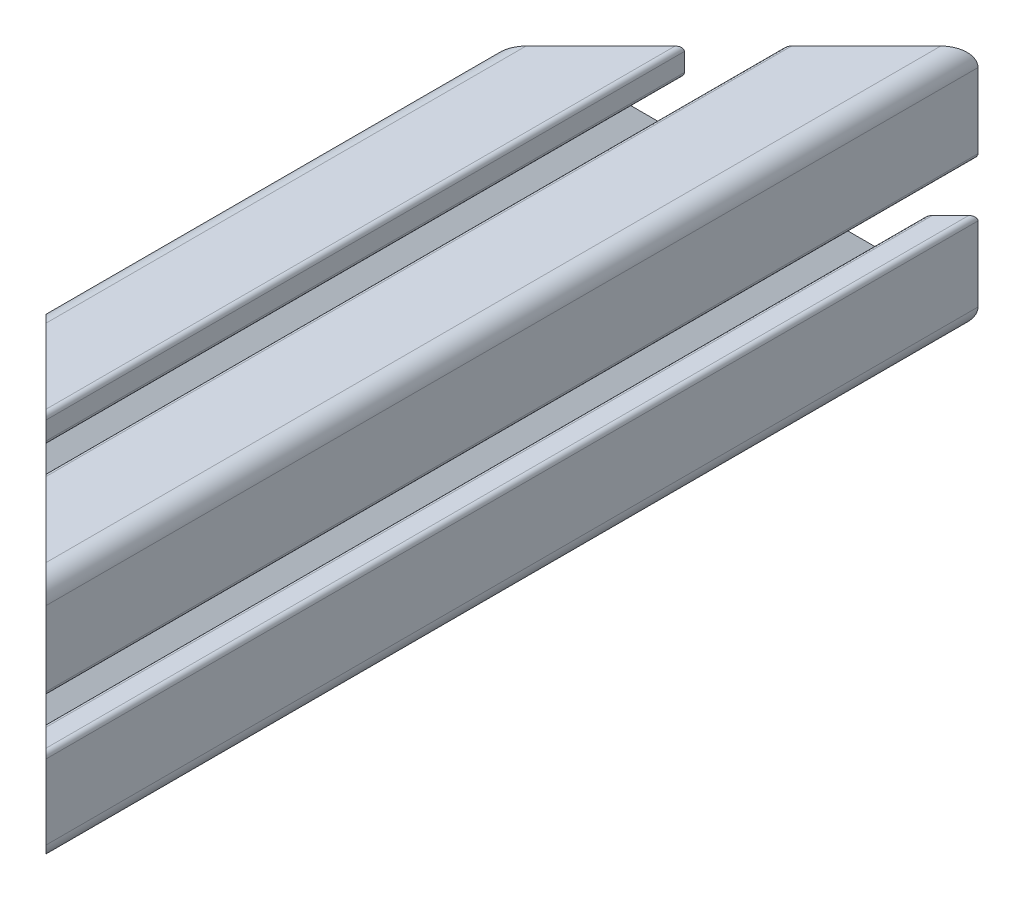
from build123d import *

# Parameters (mm, degrees)
SKETCH1_R          = 3.4036
EXTRUDE1_DEPTH     = 76.2
CUT_EXTRUDE1_DEPTH = 88.016609357
CUT_EXTRUDE2_DEPTH = 88.016609357
CUT_EXTRUDE3_REACH = 89.017
CUT_EXTRUDE5_DEPTH = 88.016609357


with BuildPart() as part:
    # Sketch1 → Extrude1 (new, symmetric)
    with BuildSketch(Plane.XY):
        with BuildLine():
            Line((-20, 16.952), (-20, 4.7625))
            ThreePointArc((-20, 4.7625), (-19.776815367, 4.223684633), (-19.238, 4.0005))
            Line((-19.238, 4.0005), (-16.2662, 4.0005))
            ThreePointArc((-16.2662, 4.0005), (-15.727384633, 4.223684633), (-15.5042, 4.7625))
            Line((-15.5042, 4.7625), (-15.5042, 10.485558599))
            ThreePointArc((-15.5042, 10.485558599), (-15.033804775, 11.189554802), (-14.203384633, 11.024373966))
            Line((-14.203384633, 11.024373966), (-8.635059555, 5.456048889))
            ThreePointArc((-8.635059555, 5.456048889), (-7.985348265, 4.483687227), (-7.7572, 3.336708444))
            Line((-7.7572, 3.336708444), (-7.7572, -3.336708444))
            ThreePointArc((-7.7572, -3.336708444), (-7.985348265, -4.483687227), (-8.635059555, -5.456048889))
            Line((-8.635059555, -5.456048889), (-14.203384633, -11.024373966))
            ThreePointArc((-14.203384633, -11.024373966), (-15.033804775, -11.189554802), (-15.5042, -10.485558599))
            Line((-15.5042, -10.485558599), (-15.5042, -4.7625))
            ThreePointArc((-15.5042, -4.7625), (-15.727384633, -4.223684633), (-16.2662, -4.0005))
            Line((-16.2662, -4.0005), (-19.238, -4.0005))
            ThreePointArc((-19.238, -4.0005), (-19.776815367, -4.223684633), (-20, -4.7625))
            Line((-20, -4.7625), (-20, -16.952))
            ThreePointArc((-20, -16.952), (-19.107261469, -19.107261469), (-16.952, -20))
            Line((-16.952, -20), (-4.7625, -20))
            ThreePointArc((-4.7625, -20), (-4.223684633, -19.776815367), (-4.0005, -19.238))
            Line((-4.0005, -19.238), (-4.0005, -16.2662))
            ThreePointArc((-4.0005, -16.2662), (-4.223684633, -15.727384633), (-4.7625, -15.5042))
            Line((-4.7625, -15.5042), (-10.485558599, -15.5042))
            ThreePointArc((-10.485558599, -15.5042), (-11.189554802, -15.033804775), (-11.024373966, -14.203384633))
            Line((-11.024373966, -14.203384633), (-5.456048889, -8.635059555))
            ThreePointArc((-5.456048889, -8.635059555), (-4.483687227, -7.985348265), (-3.336708444, -7.7572))
            Line((-3.336708444, -7.7572), (3.336708444, -7.7572))
            ThreePointArc((3.336708444, -7.7572), (4.483687227, -7.985348265), (5.456048889, -8.635059555))
            Line((5.456048889, -8.635059555), (11.024373966, -14.203384633))
            ThreePointArc((11.024373966, -14.203384633), (11.189554802, -15.033804775), (10.485558599, -15.5042))
            Line((10.485558599, -15.5042), (4.7625, -15.5042))
            ThreePointArc((4.7625, -15.5042), (4.223684633, -15.727384633), (4.0005, -16.2662))
            Line((4.0005, -16.2662), (4.0005, -19.238))
            ThreePointArc((4.0005, -19.238), (4.223684633, -19.776815367), (4.7625, -20))
            Line((4.7625, -20), (16.952, -20))
            ThreePointArc((16.952, -20), (19.107261469, -19.107261469), (20, -16.952))
            Line((20, -16.952), (20, -4.7625))
            ThreePointArc((20, -4.7625), (19.776815367, -4.223684633), (19.238, -4.0005))
            Line((19.238, -4.0005), (16.2662, -4.0005))
            ThreePointArc((16.2662, -4.0005), (15.727384633, -4.223684633), (15.5042, -4.7625))
            Line((15.5042, -4.7625), (15.5042, -10.485558599))
            ThreePointArc((15.5042, -10.485558599), (15.033804775, -11.189554802), (14.203384633, -11.024373966))
            Line((14.203384633, -11.024373966), (8.635059555, -5.456048889))
            ThreePointArc((8.635059555, -5.456048889), (7.985348265, -4.483687227), (7.7572, -3.336708444))
            Line((7.7572, -3.336708444), (7.7572, 3.336708444))
            ThreePointArc((7.7572, 3.336708444), (7.985348265, 4.483687227), (8.635059555, 5.456048889))
            Line((8.635059555, 5.456048889), (14.203384633, 11.024373966))
            ThreePointArc((14.203384633, 11.024373966), (15.033804775, 11.189554802), (15.5042, 10.485558599))
            Line((15.5042, 10.485558599), (15.5042, 4.7625))
            ThreePointArc((15.5042, 4.7625), (15.727384633, 4.223684633), (16.2662, 4.0005))
            Line((16.2662, 4.0005), (19.238, 4.0005))
            ThreePointArc((19.238, 4.0005), (19.776815367, 4.223684633), (20, 4.7625))
            Line((20, 4.7625), (20, 16.952))
            ThreePointArc((20, 16.952), (19.107261469, 19.107261469), (16.952, 20))
            Line((16.952, 20), (4.7625, 20))
            ThreePointArc((4.7625, 20), (4.223684633, 19.776815367), (4.0005, 19.238))
            Line((4.0005, 19.238), (4.0005, 16.2662))
            ThreePointArc((4.0005, 16.2662), (4.223684633, 15.727384633), (4.7625, 15.5042))
            Line((4.7625, 15.5042), (10.485558599, 15.5042))
            ThreePointArc((10.485558599, 15.5042), (11.189554802, 15.033804775), (11.024373966, 14.203384633))
            Line((11.024373966, 14.203384633), (5.456048889, 8.635059555))
            ThreePointArc((5.456048889, 8.635059555), (4.483687227, 7.985348265), (3.336708444, 7.7572))
            Line((3.336708444, 7.7572), (-3.336708444, 7.7572))
            ThreePointArc((-3.336708444, 7.7572), (-4.483687227, 7.985348265), (-5.456048889, 8.635059555))
            Line((-5.456048889, 8.635059555), (-11.024373966, 14.203384633))
            ThreePointArc((-11.024373966, 14.203384633), (-11.189554802, 15.033804775), (-10.485558599, 15.5042))
            Line((-10.485558599, 15.5042), (-4.7625, 15.5042))
            ThreePointArc((-4.7625, 15.5042), (-4.223684633, 15.727384633), (-4.0005, 16.2662))
            Line((-4.0005, 16.2662), (-4.0005, 19.238))
            ThreePointArc((-4.0005, 19.238), (-4.223684633, 19.776815367), (-4.7625, 20))
            Line((-4.7625, 20), (-16.952, 20))
            ThreePointArc((-16.952, 20), (-19.107261469, 19.107261469), (-20, 16.952))
        make_face()
        with Locations(Location((0, 0, 0), (0, 0, 180))):
            Circle(SKETCH1_R, mode=Mode.SUBTRACT)
    extrude(amount=EXTRUDE1_DEPTH, both=True)

    # Sketch3 → Cut-Extrude1 (cut, through all)
    with BuildSketch(Plane(origin=(0, 16.952, 0), x_dir=(1, 0, 0), z_dir=(0, 1, 0))):
        Polygon((20, -76.2), (-20, -36.2), (-20, -76.2), align=None)
    extrude(amount=-CUT_EXTRUDE1_DEPTH, mode=Mode.SUBTRACT)

    # Sketch4 → Cut-Extrude2 (cut, through all)
    with BuildSketch(Plane(origin=(0, 16.952, 0), x_dir=(-1, 0, 0), z_dir=(0, -1, 0))):
        Polygon((20, -36.2), (-20, -76.2), (20, -76.2), align=None)
    extrude(amount=-CUT_EXTRUDE2_DEPTH, mode=Mode.SUBTRACT)

    # Sketch5 → Cut-Extrude3 (cut, up to next)
    with BuildSketch(Plane(origin=(0, 16.952, 0), x_dir=(1, 0, 0), z_dir=(0, 1, 0)), mode=Mode.PRIVATE) as cut_extrude3_sk1:
        Polygon((20, 76.2), (-20, 76.2), (-20, 36.2), align=None)
    cut_extrude3_tool1 = extrude(cut_extrude3_sk1.sketch, amount=-CUT_EXTRUDE3_REACH, mode=Mode.PRIVATE) & part.part
    add(cut_extrude3_tool1.solids().sort_by_distance((-6.666667, 16.952, -62.866667))[0], mode=Mode.SUBTRACT)

    # Sketch7 → Cut-Extrude5 (cut, through all)
    with BuildSketch(Plane(origin=(0, 16.952, 0), x_dir=(-1, 0, 0), z_dir=(0, -1, 0))):
        Polygon((20, 36.2), (20, 76.2), (-20, 76.2), align=None)
    extrude(amount=-CUT_EXTRUDE5_DEPTH, mode=Mode.SUBTRACT)


solid = part.part
